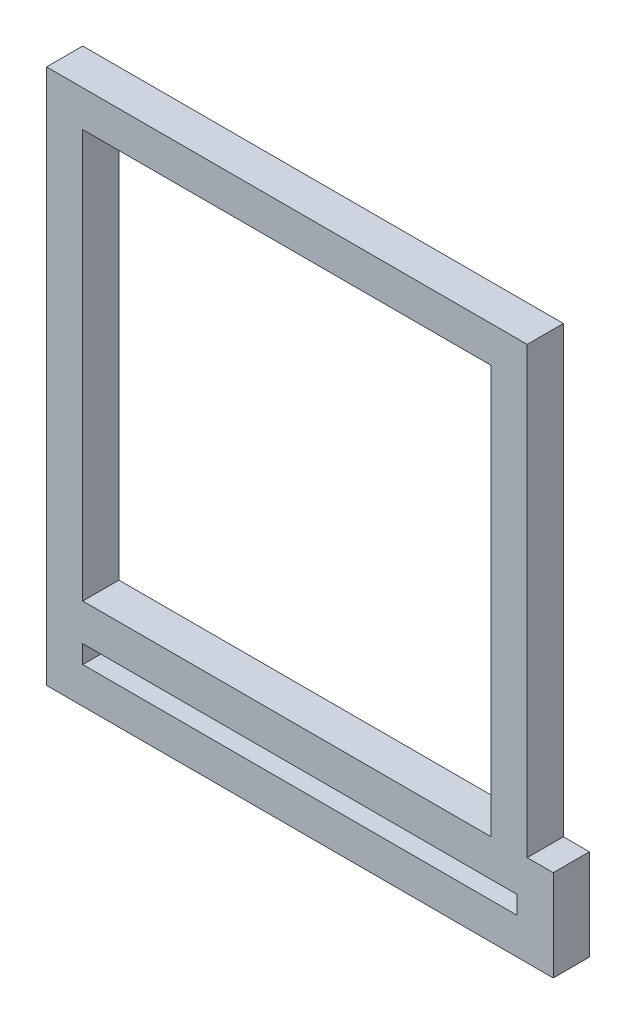
from build123d import *

# Parameters (mm, degrees)
SKETCH_1_W          = 70
SKETCH_1_H          = 74
EXTRUDE_1_DEPTH     = 5
CUT_EXTRUDE_2_REACH = 103.985
SKETCH_2_W          = 60
SKETCH_2_H          = 2.5
SKETCH_3_W          = 56.4
SKETCH_3_H          = 56.4
CUT_EXTRUDE_3_DEPTH = 20
SKETCH_4_W          = 3.6
SKETCH_4_H          = 61.4
CUT_EXTRUDE_5_DEPTH = 102.985293057


with BuildPart() as part:
    # Эскиз1 → Вытянуть1 (new body)
    with BuildSketch(Plane.XY):
        with Locations((35, 37)):
            Rectangle(SKETCH_1_W, SKETCH_1_H)
    extrude(amount=EXTRUDE_1_DEPTH)

    # Эскиз2 → Вытянуть2 (cut, up to next)
    with BuildSketch(Plane.XY.offset(5), mode=Mode.PRIVATE) as cut_extrude_2_sk1:
        with Locations((35, 6.25)):
            Rectangle(SKETCH_2_W, SKETCH_2_H)
    cut_extrude_2_tool1 = extrude(cut_extrude_2_sk1.sketch, amount=-CUT_EXTRUDE_2_REACH, mode=Mode.PRIVATE) & part.part
    add(cut_extrude_2_tool1.solids().sort_by_distance((35, 6.25, 5))[0], mode=Mode.SUBTRACT)

    # Эскиз3 → Вытянуть3 (cut)
    with BuildSketch(Plane.XY.offset(5)):
        with Locations((33.2, 40.8)):
            Rectangle(SKETCH_3_W, SKETCH_3_H)
    extrude(amount=-CUT_EXTRUDE_3_DEPTH, mode=Mode.SUBTRACT)

    # Эскиз4 → Вытянуть5 (cut, through all)
    with BuildSketch(Plane(origin=(0, 0, 0), x_dir=(-1, 0, 0), z_dir=(0, 0, -1))):
        with Locations((-68.2, 43.3)):
            Rectangle(SKETCH_4_W, SKETCH_4_H)
    extrude(amount=-CUT_EXTRUDE_5_DEPTH, mode=Mode.SUBTRACT)


solid = part.part
